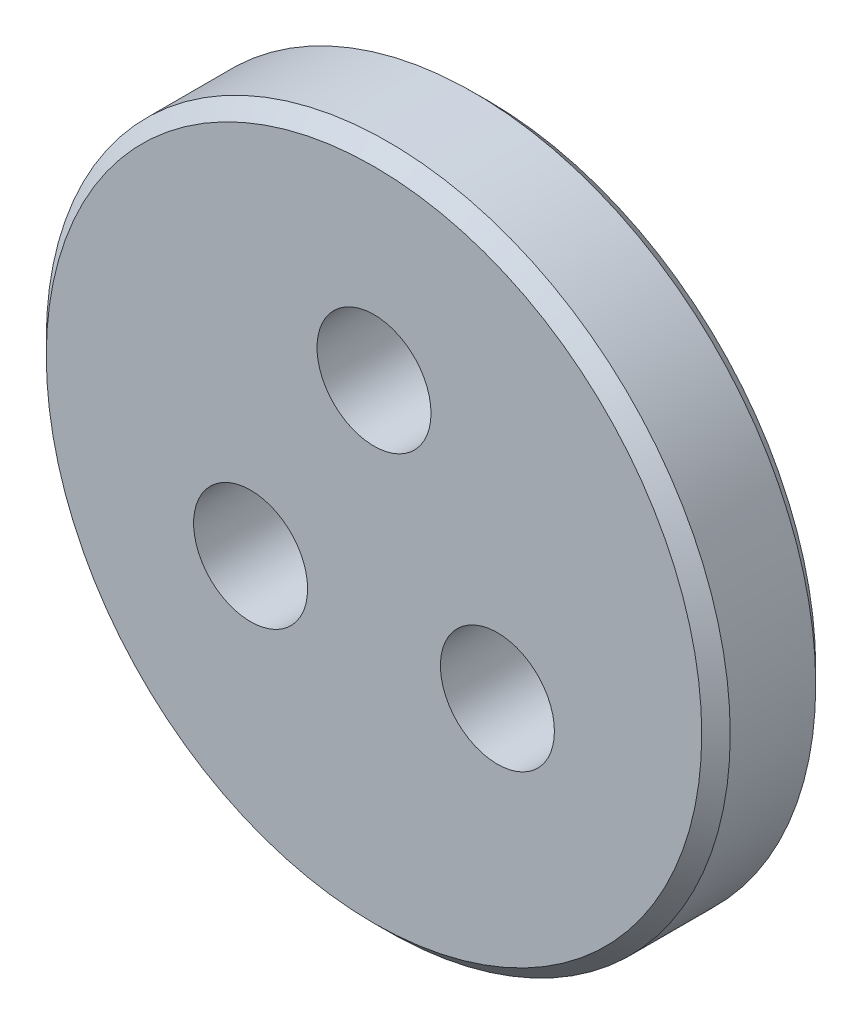
from build123d import *

# Parameters (mm, degrees)
SKETCH_1_R      = 12
SKETCH_1_R_2    = 2
EXTRUDE_1_DEPTH = 4
CHAMFER_1_SIZE  = 0.5


with BuildPart() as part:
    # 草图1 → 凸台-拉伸1 (new body)
    with BuildSketch(Plane.XY):
        Circle(SKETCH_1_R)
        with Locations((0, 5)):
            Circle(SKETCH_1_R_2, mode=Mode.SUBTRACT)
        with Locations((4.330127019, -2.5)):
            Circle(SKETCH_1_R_2, mode=Mode.SUBTRACT)
        with Locations((-4.330127019, -2.5)):
            Circle(SKETCH_1_R_2, mode=Mode.SUBTRACT)
    extrude(amount=EXTRUDE_1_DEPTH)

    # 倒角1
    chamfer_1_edges = [part.edges().sort_by_distance(p)[0] for p in [
        (-12, 0, 0),
        (-12, 0, 4),
    ]]
    chamfer(chamfer_1_edges, length=CHAMFER_1_SIZE)


solid = part.part
